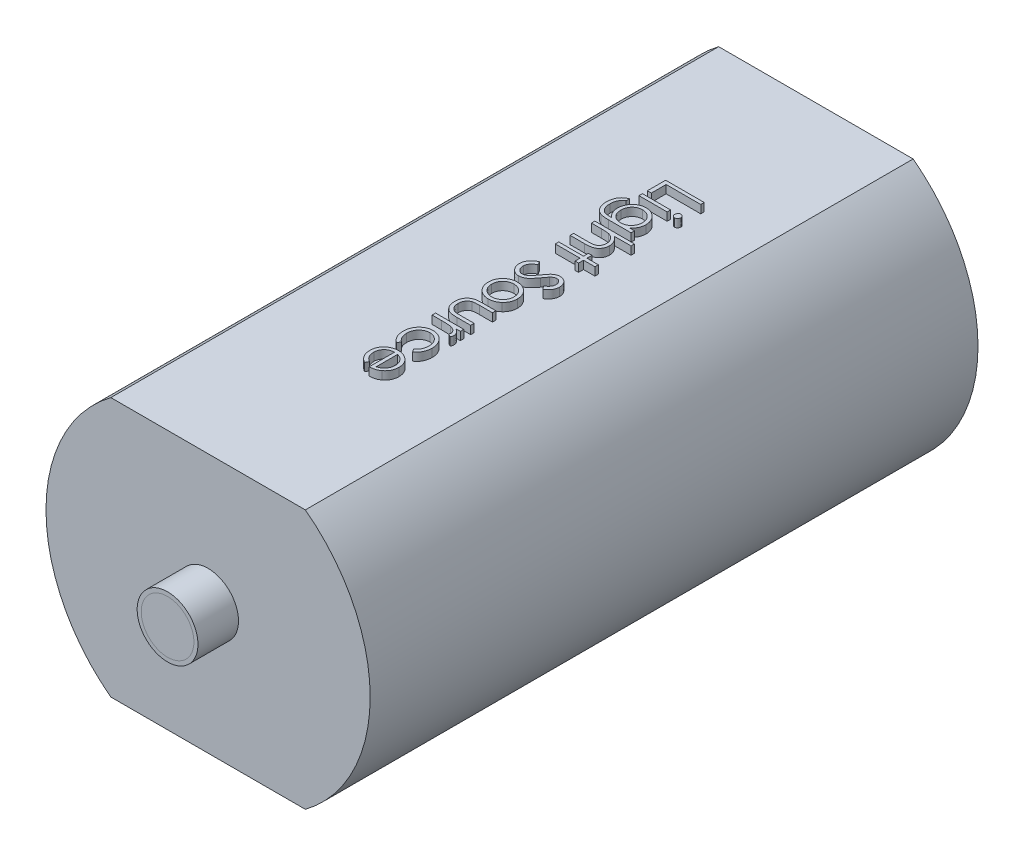
from build123d import *

# Parameters (mm, degrees)
BOSS_EXTRUDE1_DEPTH = 150
BOSS_EXTRUDE2_DEPTH = 2
BOSS_EXTRUDE3_START = -2
BOSS_EXTRUDE3_DEPTH = 2
SKETCH5_R           = 5
CUT_EXTRUDE1_DEPTH  = 5
SKETCH6_W           = 6.960576923
SKETCH6_H           = 0.854807692
BOSS_EXTRUDE4_DEPTH = 2
BOSS_EXTRUDE5_START = 8
SKETCH7_R           = 6.5
SKETCH7_R_2         = 5
BOSS_EXTRUDE5_DEPTH = 8
BOSS_EXTRUDE6_START = 10
SKETCH8_R           = 7.5
SKETCH8_R_2         = 6.5
BOSS_EXTRUDE6_DEPTH = 10
SKETCH9_R           = 6.5
BOSS_EXTRUDE8_DEPTH = 2


with BuildPart() as part:
    # Sketch2 → Boss-Extrude1 (new body)
    with BuildSketch(Plane.XY):
        with BuildLine():
            Line((-24, 32), (24, 32))
            ThreePointArc((24, 32), (40, 0), (24, -32))
            Line((24, -32), (-24, -32))
            ThreePointArc((-24, -32), (-40, 0), (-24, 32))
        make_face()
        with BuildLine():
            Line((-22.803508502, -28.5), (22.803508502, -28.5))
            ThreePointArc((22.803508502, -28.5), (36.5, 0), (22.803508502, 28.5))
            Line((22.803508502, 28.5), (-22.803508502, 28.5))
            ThreePointArc((-22.803508502, 28.5), (-36.5, 0), (-22.803508502, -28.5))
        make_face(mode=Mode.SUBTRACT)
    extrude(amount=BOSS_EXTRUDE1_DEPTH)

    # Sketch3 → Boss-Extrude2 (add)
    with BuildSketch(Plane(origin=(0, 0, 0), x_dir=(-1, 0, 0), z_dir=(0, 0, -1))):
        with BuildLine():
            Line((-24, 32), (24, 32))
            ThreePointArc((24, 32), (40, 0), (24, -32))
            Line((24, -32), (-24, -32))
            ThreePointArc((-24, -32), (-40, 0), (-24, 32))
        make_face()
    extrude(amount=-BOSS_EXTRUDE2_DEPTH)

    # Sketch4 → Boss-Extrude3 (add)
    with BuildSketch(Plane.XY.offset(150).offset(BOSS_EXTRUDE3_START)):
        with BuildLine():
            Line((-24, 32), (24, 32))
            ThreePointArc((24, 32), (40, 0), (24, -32))
            Line((24, -32), (-24, -32))
            ThreePointArc((-24, -32), (-40, 0), (-24, 32))
        make_face()
    extrude(amount=BOSS_EXTRUDE3_DEPTH)

    # Sketch5 → Cut-Extrude1 (cut)
    with BuildSketch(Plane.XY.offset(150)):
        Circle(SKETCH5_R)
    extrude(amount=-CUT_EXTRUDE1_DEPTH, mode=Mode.SUBTRACT)

    # Sketch6 → Boss-Extrude4 (add)
    # profile 1 of 12: a face of its own
    with BuildSketch(Plane(origin=(0, 32, 0), x_dir=(1, 0, 0), z_dir=(0, 1, 0))):
        Polygon((9.525, -37.083173077), (9.525, -37.937980769), (0.976923077, -37.937980769), (0.976923077, -41.601442308), (0, -41.601442308), (0, -37.083173077), align=None)
    # profile 2 of 12: a face of its own
    with BuildSketch(Plane(origin=(0, 32, 0), x_dir=(1, 0, 0), z_dir=(0, 1, 0))):
        with BuildLine():
            add(Edge.make_bspline(
                [(9.891346154, -43.246183894), (9.888874894, -43.299219261), (9.884035694, -43.403072696), (9.842926421, -43.553403032), (9.772180781, -43.690151542), (9.680351215, -43.813254251), (9.567915071, -43.915300738), (9.440162758, -43.9884735), (9.301084477, -44.035186768), (9.204177694, -44.040860982), (9.15483774, -44.04375)],
                knots=[0, 0, 0, 0, 1.054986045, 2.065865298, 3.074122704, 4.105114675, 5.109626121, 6.074217918, 7.019490725, 8, 8, 8, 8], degree=3))
            add(Edge.make_bspline(
                [(9.15483774, -44.04375), (9.106778498, -44.040796353), (9.011771064, -44.034957341), (8.875104224, -43.988508032), (8.749130834, -43.91468727), (8.636914511, -43.813322172), (8.545137995, -43.690133603), (8.474378339, -43.553407777), (8.43327277, -43.403071448), (8.428433059, -43.299218839), (8.425961538, -43.246183894)],
                knots=[0, 0, 0, 0, 0.961106377, 1.899993565, 2.859409042, 3.870007927, 4.90724781, 5.921615355, 6.938620636, 8, 8, 8, 8], degree=3))
            add(Edge.make_bspline(
                [(8.425961538, -43.246183894), (8.428353682, -43.193758068), (8.433009677, -43.091718046), (8.474870132, -42.944151843), (8.544984123, -42.809603665), (8.638184575, -42.688514146), (8.74838467, -42.58513934), (8.87519938, -42.511590956), (9.011746837, -42.465017456), (9.10677036, -42.459195181), (9.15483774, -42.45625)],
                knots=[0, 0, 0, 0, 1.055304112, 2.054011575, 3.063363921, 4.096942562, 5.122536081, 6.088009498, 7.032825006, 8, 8, 8, 8], degree=3))
            add(Edge.make_bspline(
                [(9.15483774, -42.45625), (9.204186142, -42.459130237), (9.301109515, -42.464787205), (9.440065974, -42.511627105), (9.568667601, -42.584518305), (9.679082072, -42.68858094), (9.772334315, -42.809586178), (9.842434763, -42.944156396), (9.884298758, -43.091716837), (9.888954262, -43.193757657), (9.891346154, -43.246183894)],
                knots=[0, 0, 0, 0, 0.986662878, 1.937868148, 2.908513651, 3.927890639, 4.955204348, 5.958438607, 6.951092507, 8, 8, 8, 8], degree=3))
        make_face()
    # profile 3 of 12: a face of its own
    with BuildSketch(Plane(origin=(0, 32, 0), x_dir=(1, 0, 0), z_dir=(0, 1, 0))):
        with Locations((3.480288462, -43.25)):
            Rectangle(SKETCH6_W, SKETCH6_H)
    # profile 4 of 12: a face of its own
    with BuildSketch(Plane(origin=(0, 32, 0), x_dir=(1, 0, 0), z_dir=(0, 1, 0))):
        with BuildLine():
            Line((6.960576923, -51.737019231), (6.960576923, -52.591826923))
            Line((6.960576923, -52.591826923), (1.436763822, -52.591826923))
            add(Edge.make_bspline(
                [(1.436763822, -52.591826923), (1.319095797, -52.591072972), (1.091968164, -52.589617663), (0.763550846, -52.57913752), (0.460203856, -52.557037677), (0.180543709, -52.531976909), (-0.074133319, -52.495926916), (-0.304587169, -52.451904088), (-0.511038992, -52.40227699), (-0.638197309, -52.358679113), (-0.698347356, -52.338055889)],
                knots=[0, 0, 0, 0, 1.307562039, 2.523909702, 3.650326591, 4.686913197, 5.643429486, 6.506965704, 7.293745905, 8, 8, 8, 8], degree=3))
            add(Edge.make_bspline(
                [(-0.698347356, -52.338055889), (-0.776536507, -52.307608124), (-0.930577004, -52.247622962), (-1.148889906, -52.13522473), (-1.354628821, -52.009559353), (-1.545442913, -51.865524337), (-1.72433437, -51.706763564), (-1.88817937, -51.530361741), (-2.039520798, -51.339455439), (-2.175364408, -51.132491085), (-2.29439933, -50.91156535), (-2.399758422, -50.679616526), (-2.490753345, -50.437315148), (-2.559052217, -50.182330588), (-2.618191216, -49.918536009), (-2.6566879, -49.642863926), (-2.682886441, -49.356915362), (-2.685309258, -49.162481926), (-2.686538462, -49.063837139)],
                knots=[0, 0, 0, 0, 0.981884813, 1.934411902, 2.870642727, 3.801527012, 4.729816098, 5.667674509, 6.616731011, 7.579249157, 8.562291171, 9.552107921, 10.560574871, 11.588648803, 12.640348669, 13.724070705, 14.845319185, 16, 16, 16, 16], degree=3))
            add(Edge.make_bspline(
                [(-2.686538462, -49.063837139), (-2.684212763, -48.919913681), (-2.679670049, -48.638792499), (-2.626554881, -48.228951716), (-2.551939987, -47.84021894), (-2.437815674, -47.477513583), (-2.298736214, -47.142237326), (-2.140327407, -46.835894723), (-1.956858752, -46.56352425), (-1.748745355, -46.318217761), (-1.501172588, -46.096863957), (-1.209445115, -45.888596924), (-0.869082516, -45.688134995), (-0.619275499, -45.570654474), (-0.488461538, -45.509134615)],
                knots=[0, 0, 0, 0, 1.157931887, 2.261752077, 3.322178827, 4.340878186, 5.316509817, 6.24181319, 7.112369066, 7.954886437, 8.824930176, 9.778504873, 10.836691706, 12, 12, 12, 12], degree=3))
            Line((-0.488461538, -45.509134615), (-0.488461538, -46.363942308))
            add(Edge.make_bspline(
                [(-0.488461538, -46.363942308), (-0.597606815, -46.432691606), (-0.81097239, -46.567088018), (-1.087233192, -46.818407813), (-1.323326278, -47.093833601), (-1.513583456, -47.402660453), (-1.657029388, -47.746173361), (-1.759287873, -48.124578985), (-1.820509857, -48.540956527), (-1.82788845, -48.830838238), (-1.831730769, -48.981790865)],
                knots=[0, 0, 0, 0, 0.997731894, 1.950442991, 2.880492273, 3.800895997, 4.748200782, 5.754801363, 6.83083817, 8, 8, 8, 8], degree=3))
            add(Edge.make_bspline(
                [(-1.831730769, -48.981790865), (-1.827856415, -49.130838927), (-1.820387048, -49.418188672), (-1.75898545, -49.831942712), (-1.657286173, -50.209870079), (-1.514366806, -50.549132128), (-1.337851416, -50.844603781), (-1.142558315, -51.100204133), (-0.921552992, -51.307380219), (-0.718057281, -51.446763229), (-0.536742051, -51.533397415), (-0.380661615, -51.588567193), (-0.204168968, -51.633399821), (-0.007856768, -51.670900697), (0.208555758, -51.701845815), (0.445563344, -51.721447948), (0.702627371, -51.735615192), (0.880862269, -51.736540396), (0.973106971, -51.737019231)],
                knots=[0, 0, 0, 0, 1.570672572, 3.028099501, 4.397683431, 5.686589315, 6.895122698, 8.017723291, 9.066023084, 10.075791025, 10.603605416, 11.180458235, 11.81795017, 12.521450677, 13.286658401, 14.121327423, 15.027701111, 16, 16, 16, 16], degree=3))
            Line((0.973106971, -51.737019231), (1.333728966, -51.737019231))
            add(Edge.make_bspline(
                [(1.333728966, -51.737019231), (1.230473062, -51.650257047), (1.025777493, -51.4782588), (0.757549039, -51.181222145), (0.526537498, -50.856781825), (0.337075357, -50.505490184), (0.185542337, -50.135952182), (0.079561851, -49.752170255), (0.01109098, -49.357584734), (0.003723213, -49.090198526), (0, -48.955078125)],
                knots=[0, 0, 0, 0, 1.012485704, 2.007162095, 2.997754123, 3.998611389, 4.999708251, 5.992315798, 6.98544096, 8, 8, 8, 8], degree=3))
            add(Edge.make_bspline(
                [(0, -48.955078125), (0.001401608, -48.875513706), (0.004188237, -48.717326432), (0.02856891, -48.482318155), (0.063944058, -48.250777819), (0.115872832, -48.023245426), (0.182525315, -47.799392649), (0.265846586, -47.579589422), (0.360049144, -47.362056017), (0.471009469, -47.150746705), (0.594459553, -46.947765559), (0.72818824, -46.75464548), (0.871491429, -46.572391142), (1.025797613, -46.402762468), (1.190826863, -46.245888966), (1.365029516, -46.100006429), (1.549775924, -45.966433691), (1.745137993, -45.846901887), (1.946352573, -45.737697746), (2.15438347, -45.644199193), (2.367914601, -45.566583371), (2.5842765, -45.498179967), (2.80741461, -45.449741906), (3.034684282, -45.412703335), (3.267472046, -45.391922305), (3.424281329, -45.38866051), (3.503185096, -45.387019231)],
                knots=[0, 0, 0, 0, 1.028796061, 2.045417375, 3.052978994, 4.056772505, 5.061374657, 6.071351207, 7.095367434, 8.125609542, 9.155490328, 10.16637099, 11.162041966, 12.151987513, 13.129482149, 14.104793677, 15.088808581, 16.075021637, 17.065069715, 18.0481558, 19.021557435, 20.00254184, 20.980451754, 21.971763498, 22.979425854, 24, 24, 24, 24], degree=3))
            add(Edge.make_bspline(
                [(3.503185096, -45.387019231), (3.582115328, -45.388431116), (3.739670084, -45.391249418), (3.973379087, -45.415623544), (4.203985134, -45.450316479), (4.428986177, -45.505514043), (4.651630435, -45.571009735), (4.868293123, -45.655954952), (5.081841561, -45.753822676), (5.290403069, -45.865680814), (5.492058859, -45.99089403), (5.68267881, -46.128720032), (5.863848478, -46.276277569), (6.033244189, -46.436536188), (6.192135627, -46.608548575), (6.339128504, -46.792814743), (6.476879752, -46.987285199), (6.602366064, -47.192626019), (6.713352678, -47.40565156), (6.814623934, -47.620954369), (6.894998975, -47.841385226), (6.965818968, -48.062834794), (7.015989038, -48.289202987), (7.054693853, -48.517714252), (7.078274273, -48.7491509), (7.081217729, -48.904144136), (7.082692308, -48.981790865)],
                knots=[0, 0, 0, 0, 1.008914434, 2.013921196, 3.001938835, 3.98818112, 4.973517748, 5.967241793, 6.960633033, 7.975722852, 8.991170928, 9.993245185, 10.981396684, 11.976616977, 12.972235889, 13.973022409, 14.988340224, 16.01763096, 17.047082309, 18.058647952, 19.057085865, 20.044802253, 21.029198803, 22.0185208, 23.007341325, 24, 24, 24, 24], degree=3))
            add(Edge.make_bspline(
                [(7.082692308, -48.981790865), (7.079057748, -49.109846972), (7.071898471, -49.362089154), (7.013979645, -49.734040119), (6.923706773, -50.09334427), (6.79247814, -50.441842207), (6.614889534, -50.781661128), (6.377964948, -51.110755863), (6.086384261, -51.434760282), (5.860533524, -51.633700644), (5.743239183, -51.737019231)],
                knots=[0, 0, 0, 0, 0.967343326, 1.905452219, 2.838102277, 3.762990896, 4.713322225, 5.726933809, 6.819495538, 8, 8, 8, 8], degree=3))
            Line((5.743239183, -51.737019231), (6.960576923, -51.737019231))
        make_face()
        with BuildLine():
            add(Edge.make_bspline(
                [(6.227884615, -49.050480769), (6.223636325, -48.925483586), (6.21522561, -48.678015668), (6.14342095, -48.315281741), (6.0309031, -47.965093733), (5.869942876, -47.634164328), (5.67377244, -47.324133342), (5.435976632, -47.049214849), (5.165183465, -46.808305294), (4.861271923, -46.60704186), (4.534894664, -46.445322634), (4.191315396, -46.327748507), (3.834492943, -46.254283337), (3.591303756, -46.245998797), (3.468840144, -46.241826923)],
                knots=[0, 0, 0, 0, 1.026331696, 2.03191913, 3.02692423, 4.041490544, 5.047661868, 6.033509946, 7.018359977, 8.017132933, 9.01989117, 10.003339456, 10.994534818, 12, 12, 12, 12], degree=3))
            add(Edge.make_bspline(
                [(3.468840144, -46.241826923), (3.376492611, -46.243801117), (3.194872018, -46.24768378), (2.928348957, -46.285044364), (2.674464372, -46.345361457), (2.43337267, -46.431084349), (2.20276399, -46.536604856), (1.98690216, -46.672518961), (1.781826533, -46.828942259), (1.591751715, -47.008368635), (1.418376344, -47.205777586), (1.266831323, -47.419759668), (1.141181567, -47.649142979), (1.034197908, -47.890262268), (0.955495923, -48.148222335), (0.895549708, -48.419155062), (0.861227364, -48.704877759), (0.856975503, -48.899655789), (0.854807692, -48.998963341)],
                knots=[0, 0, 0, 0, 1.039892369, 2.045164194, 3.025377528, 3.974939947, 4.923826224, 5.876304068, 6.842270891, 7.825700405, 8.815919897, 9.798017152, 10.773083594, 11.758208475, 12.764450271, 13.80592145, 14.881349344, 16, 16, 16, 16], degree=3))
            add(Edge.make_bspline(
                [(0.854807692, -48.998963341), (0.856896685, -49.09955757), (0.860981689, -49.296268517), (0.896097642, -49.583572272), (0.952763151, -49.855804258), (1.033216856, -50.112714695), (1.13587375, -50.355274194), (1.265786118, -50.580755772), (1.413732898, -50.794002234), (1.586312168, -50.988174957), (1.776469446, -51.163842177), (1.983529788, -51.316614807), (2.203497171, -51.447822291), (2.439176067, -51.552250178), (2.687452139, -51.638390889), (2.952511814, -51.692697383), (3.230453889, -51.731646122), (3.420991701, -51.735200969), (3.518449519, -51.737019231)],
                knots=[0, 0, 0, 0, 1.121992135, 2.194043731, 3.223932285, 4.220423016, 5.193184374, 6.156086365, 7.118779155, 8.084057622, 9.048292205, 10.002025119, 10.950065319, 11.899697616, 12.87359713, 13.875731462, 14.913461982, 16, 16, 16, 16], degree=3))
            add(Edge.make_bspline(
                [(3.518449519, -51.737019231), (3.645316681, -51.733373692), (3.893170533, -51.726251591), (4.254322496, -51.659040032), (4.59387163, -51.550672206), (4.910743453, -51.398689143), (5.20158266, -51.208238531), (5.460994665, -50.978845435), (5.689343867, -50.714475393), (5.879493437, -50.415851608), (6.033696536, -50.094135124), (6.147859499, -49.757643976), (6.214032895, -49.407327073), (6.223232664, -49.170323757), (6.227884615, -49.050480769)],
                knots=[0, 0, 0, 0, 1.070930318, 2.092221514, 3.091405799, 4.074392322, 5.052047932, 6.019043127, 6.99061078, 7.993717296, 9.000730765, 9.998165278, 10.987753177, 12, 12, 12, 12], degree=3))
        make_face(mode=Mode.SUBTRACT)
    # profile 5 of 12: a face of its own
    with BuildSketch(Plane(origin=(0, 32, 0), x_dir=(1, 0, 0), z_dir=(0, 1, 0))):
        with BuildLine():
            Line((9.769230769, -54.545673077), (9.769230769, -55.400480769))
            Line((9.769230769, -55.400480769), (5.645928486, -55.400480769))
            add(Edge.make_bspline(
                [(5.645928486, -55.400480769), (5.76047368, -55.492377719), (5.983145158, -55.671021875), (6.276608294, -55.969802772), (6.527135899, -56.280343163), (6.729033709, -56.607867075), (6.887190807, -56.947824842), (7.000945042, -57.301986669), (7.069352045, -57.670968677), (7.078214125, -57.922004731), (7.082692308, -58.048858173)],
                knots=[0, 0, 0, 0, 1.125719942, 2.188356526, 3.205611246, 4.180516366, 5.132291467, 6.075069812, 7.02729502, 8, 8, 8, 8], degree=3))
            add(Edge.make_bspline(
                [(7.082692308, -58.048858173), (7.07793518, -58.177660974), (7.068624335, -58.429759123), (6.995208914, -58.796878483), (6.869034563, -59.140018157), (6.6981125, -59.458631141), (6.484084226, -59.744283907), (6.235635383, -59.995031702), (5.949910061, -60.201572759), (5.685134355, -60.341894529), (5.44963969, -60.43327679), (5.247606949, -60.491108681), (5.022486202, -60.540147692), (4.774387578, -60.582873079), (4.502121887, -60.611349068), (4.206916923, -60.634221606), (3.888789774, -60.650486108), (3.668571094, -60.651116401), (3.554702524, -60.651442308)],
                knots=[0, 0, 0, 0, 1.23557613, 2.418320525, 3.575024647, 4.733016537, 5.875704003, 6.989294038, 8.107658508, 9.246262776, 9.854990416, 10.529125826, 11.260725398, 12.065539328, 12.943870397, 13.886749146, 14.907300446, 16, 16, 16, 16], degree=3))
            Line((3.554702524, -60.651442308), (0, -60.651442308))
            Line((0, -60.651442308), (0, -59.796634615))
            Line((0, -59.796634615), (3.27421875, -59.796634615))
            add(Edge.make_bspline(
                [(3.27421875, -59.796634615), (3.368986158, -59.796116719), (3.550260081, -59.795126071), (3.809792133, -59.791851255), (4.045185185, -59.784540912), (4.255684832, -59.772727664), (4.441584538, -59.760303506), (4.602614336, -59.743203907), (4.738995396, -59.723309628), (4.821086278, -59.705433158), (4.857902644, -59.697415865)],
                knots=[0, 0, 0, 0, 1.430932559, 2.737130458, 3.918967929, 4.986496826, 5.920444988, 6.731744033, 7.431208747, 8, 8, 8, 8], degree=3))
            add(Edge.make_bspline(
                [(4.857902644, -59.697415865), (4.965928174, -59.666325749), (5.173606626, -59.606555183), (5.455710805, -59.467629752), (5.696263256, -59.294121134), (5.891901863, -59.08224022), (6.046007113, -58.835380504), (6.151078342, -58.552300309), (6.218061824, -58.236419145), (6.22451281, -58.014247051), (6.227884615, -57.898121995)],
                knots=[0, 0, 0, 0, 1.090097712, 2.095706502, 3.037208793, 3.95517211, 4.879102211, 5.845071496, 6.873660557, 8, 8, 8, 8], degree=3))
            add(Edge.make_bspline(
                [(6.227884615, -57.898121995), (6.226589688, -57.829357555), (6.22402706, -57.693274506), (6.198298951, -57.491484208), (6.156256367, -57.295734399), (6.099366158, -57.104139901), (6.021953662, -56.920761341), (5.932336504, -56.740253543), (5.822640467, -56.567730731), (5.699561771, -56.40012933), (5.563300497, -56.244143757), (5.419481283, -56.099017821), (5.266332988, -55.969645624), (5.106312672, -55.85243753), (4.937225434, -55.751259481), (4.760701825, -55.662940736), (4.5765097, -55.588004305), (4.448670425, -55.550767836), (4.384705529, -55.532136418)],
                knots=[0, 0, 0, 0, 1.024319606, 2.027102035, 3.025350316, 4.005802111, 5.00026367, 5.987881639, 7.005602596, 8.042517216, 9.083927026, 10.089214625, 11.084353441, 12.06828073, 13.041928858, 14.016821737, 15.00770877, 16, 16, 16, 16], degree=3))
            add(Edge.make_bspline(
                [(4.384705529, -55.532136418), (4.338384227, -55.521415548), (4.237444408, -55.498053454), (4.070962855, -55.4727038), (3.877506371, -55.450013082), (3.65736838, -55.430830957), (3.409742214, -55.419065987), (3.136317675, -55.406388917), (2.835382047, -55.401669922), (2.626116416, -55.400889), (2.516721755, -55.400480769)],
                knots=[0, 0, 0, 0, 0.607992626, 1.324890765, 2.152360218, 3.099583803, 4.150613268, 5.323148443, 6.60066238, 8, 8, 8, 8], degree=3))
            Line((2.516721755, -55.400480769), (0, -55.400480769))
            Line((0, -55.400480769), (0, -54.545673077))
            Line((0, -54.545673077), (9.769230769, -54.545673077))
        make_face()
    # profile 6 of 12: a face of its own
    with BuildSketch(Plane(origin=(0, 32, 0), x_dir=(1, 0, 0), z_dir=(0, 1, 0))):
        Polygon((9.769230769, -63.460096154), (9.769230769, -64.314903846), (6.960576923, -64.314903846), (6.960576923, -65.536057692), (6.105769231, -65.536057692), (6.105769231, -64.314903846), (0, -64.314903846), (0, -63.460096154), (6.105769231, -63.460096154), (6.105769231, -62.238942308), (6.960576923, -62.238942308), (6.960576923, -63.460096154), align=None)
    # profile 7 of 12: a face of its own
    with BuildSketch(Plane(origin=(0, 32, 0), x_dir=(1, 0, 0), z_dir=(0, 1, 0))):
        with BuildLine():
            Line((1.837454928, -70.054326923), (2.320192308, -70.85952524))
            add(Edge.make_bspline(
                [(2.320192308, -70.85952524), (2.194831374, -70.934414157), (1.954644664, -71.077898433), (1.630092425, -71.317251774), (1.354242556, -71.565263483), (1.128699788, -71.823770169), (0.951129604, -72.091193928), (0.82539353, -72.369280531), (0.746972911, -72.657092859), (0.737447676, -72.852964473), (0.732692308, -72.950751202)],
                knots=[0, 0, 0, 0, 1.272034388, 2.437168799, 3.508375237, 4.49857839, 5.41946034, 6.295179144, 7.148887113, 8, 8, 8, 8], degree=3))
            add(Edge.make_bspline(
                [(0.732692308, -72.950751202), (0.735018235, -73.034263309), (0.739629391, -73.199826259), (0.783936474, -73.44356338), (0.852005035, -73.680278618), (0.949489744, -73.905090341), (1.06743016, -74.114906992), (1.209894196, -74.298871143), (1.369359642, -74.458008409), (1.54739263, -74.587825301), (1.738199915, -74.688602996), (1.935806546, -74.761528524), (2.139343317, -74.807941237), (2.277335103, -74.813848644), (2.346905048, -74.816826923)],
                knots=[0, 0, 0, 0, 1.095270387, 2.171376115, 3.241375676, 4.322296363, 5.380636668, 6.392615365, 7.366724986, 8.328592944, 9.273498763, 10.190095884, 11.087518669, 12, 12, 12, 12], degree=3))
            add(Edge.make_bspline(
                [(2.346905048, -74.816826923), (2.426209789, -74.812814692), (2.587424739, -74.804658412), (2.825276652, -74.735720598), (3.060660003, -74.627273719), (3.206259876, -74.52722681), (3.281850962, -74.475285457)],
                knots=[0, 0, 0, 0, 0.938893495, 1.908633276, 2.914225137, 4, 4, 4, 4], degree=3))
            add(Edge.make_bspline(
                [(3.281850962, -74.475285457), (3.336518486, -74.432759731), (3.451623, -74.343220226), (3.620094315, -74.187155311), (3.798118858, -74.008788198), (3.984973711, -73.807227179), (4.17724644, -73.578465642), (4.378944988, -73.327200926), (4.589463177, -73.052132338), (4.728676799, -72.858276427), (4.800661058, -72.758037861)],
                knots=[0, 0, 0, 0, 0.72226686, 1.520759855, 2.393439377, 3.351307446, 4.386958158, 5.510256019, 6.712608938, 8, 8, 8, 8], degree=3))
            add(Edge.make_bspline(
                [(4.800661058, -72.758037861), (4.872056623, -72.657837353), (5.008559508, -72.466261612), (5.210888665, -72.198140798), (5.397053846, -71.958703226), (5.564461836, -71.746728842), (5.720414125, -71.567701694), (5.856552542, -71.415077048), (5.980146722, -71.294485805), (6.060260055, -71.227379623), (6.096228966, -71.197250601)],
                knots=[0, 0, 0, 0, 1.452255772, 2.776602448, 3.96446981, 5.032613149, 5.964194703, 6.766668629, 7.446264616, 8, 8, 8, 8], degree=3))
            add(Edge.make_bspline(
                [(6.096228966, -71.197250601), (6.152293217, -71.155143174), (6.262551089, -71.072333269), (6.434885166, -70.963024354), (6.611297053, -70.870117061), (6.792260799, -70.797285285), (6.975235855, -70.735954576), (7.162609602, -70.69470335), (7.353541271, -70.668873191), (7.482029441, -70.666227999), (7.546349159, -70.664903846)],
                knots=[0, 0, 0, 0, 1.068054152, 2.10047183, 3.106115577, 4.101338837, 5.06977816, 6.043150881, 7.020423561, 8, 8, 8, 8], degree=3))
            add(Edge.make_bspline(
                [(7.546349159, -70.664903846), (7.647131483, -70.668440385), (7.84654198, -70.675437871), (8.137696321, -70.73510008), (8.416519271, -70.828169183), (8.676869209, -70.962774355), (8.918137305, -71.129196189), (9.136637375, -71.325880654), (9.321887548, -71.559400163), (9.481867178, -71.817044837), (9.608177785, -72.097236855), (9.703965527, -72.390318337), (9.757516741, -72.697574457), (9.765287727, -72.906034896), (9.769230769, -73.011808894)],
                knots=[0, 0, 0, 0, 1.005541892, 1.989591032, 2.955705311, 3.932863626, 4.905387107, 5.876519979, 6.856563935, 7.871847665, 8.897921447, 9.918317993, 10.943742853, 12, 12, 12, 12], degree=3))
            add(Edge.make_bspline(
                [(9.769230769, -73.011808894), (9.765431918, -73.124068498), (9.75789834, -73.346692717), (9.690050361, -73.674777388), (9.580454393, -73.99126258), (9.45422642, -74.246017652), (9.328719872, -74.445055117), (9.214357771, -74.596833994), (9.082710789, -74.750642981), (8.933414555, -74.907718314), (8.76510325, -75.065399748), (8.578928385, -75.226027837), (8.376028061, -75.389978318), (8.231181382, -75.495449622), (8.156926082, -75.549519231)],
                knots=[0, 0, 0, 0, 1.286821612, 2.551921131, 3.825787379, 5.12137259, 5.803616487, 6.523126609, 7.299589446, 8.125436757, 9.008162487, 9.944516264, 10.946261234, 12, 12, 12, 12], degree=3))
            Line((8.156926082, -75.549519231), (7.571153846, -74.776757812))
            add(Edge.make_bspline(
                [(7.571153846, -74.776757812), (7.631266641, -74.730096383), (7.747029829, -74.640237378), (7.909148887, -74.503813553), (8.057239525, -74.375229757), (8.185867946, -74.24854609), (8.302079565, -74.13045368), (8.401571659, -74.015834307), (8.485333921, -73.906342157), (8.574679105, -73.768308175), (8.663807537, -73.594448181), (8.737621096, -73.376418883), (8.783575179, -73.149192973), (8.789364857, -72.994854799), (8.792307692, -72.91640625)],
                knots=[0, 0, 0, 0, 1.181667846, 2.275615987, 3.290305621, 4.226321945, 5.078535498, 5.862783384, 6.581873284, 7.217493746, 8.414623899, 9.604724551, 10.782505457, 12, 12, 12, 12], degree=3))
            add(Edge.make_bspline(
                [(8.792307692, -72.91640625), (8.789010137, -72.818008857), (8.782651114, -72.628258754), (8.713200296, -72.358863897), (8.603848234, -72.116401144), (8.450591043, -71.908068806), (8.269014628, -71.734613175), (8.060066458, -71.609140463), (7.829337205, -71.533620372), (7.668387412, -71.524404854), (7.586418269, -71.519711538)],
                knots=[0, 0, 0, 0, 1.14458467, 2.207223713, 3.21896685, 4.227309161, 5.202851033, 6.127160689, 7.046193047, 8, 8, 8, 8], degree=3))
            add(Edge.make_bspline(
                [(7.586418269, -71.519711538), (7.53540047, -71.520831211), (7.433281448, -71.523072386), (7.282011827, -71.552221263), (7.132084974, -71.593553494), (6.982834225, -71.654045761), (6.830748343, -71.735526127), (6.676237941, -71.84631493), (6.515402003, -71.984916284), (6.410898736, -72.091295772), (6.355724159, -72.147460937)],
                knots=[0, 0, 0, 0, 0.858526328, 1.718456515, 2.587092892, 3.476767204, 4.426280253, 5.487868114, 6.673670035, 8, 8, 8, 8], degree=3))
            add(Edge.make_bspline(
                [(6.355724159, -72.147460937), (6.337117681, -72.168310815), (6.29291295, -72.217845352), (6.220543958, -72.308403407), (6.131273556, -72.427990594), (6.020818073, -72.573484156), (5.892689237, -72.747566762), (5.748525335, -72.950257554), (5.583646336, -73.179297154), (5.468373315, -73.341826082), (5.407421875, -73.427764423)],
                knots=[0, 0, 0, 0, 0.420754252, 0.999615792, 1.744751191, 2.668019286, 3.750313428, 4.999500688, 6.413464383, 8, 8, 8, 8], degree=3))
            add(Edge.make_bspline(
                [(5.407421875, -73.427764423), (5.332197889, -73.531140373), (5.186537067, -73.731313572), (4.967691538, -74.0161317), (4.753657253, -74.274378421), (4.545801051, -74.506960425), (4.345699598, -74.71617544), (4.150945514, -74.89970238), (3.962934063, -75.059411267), (3.721890125, -75.231348997), (3.425850174, -75.407038492), (3.063142968, -75.557918594), (2.699025838, -75.65305524), (2.454296376, -75.665496292), (2.333548678, -75.671634615)],
                knots=[0, 0, 0, 0, 1.163667725, 2.253281268, 3.268753668, 4.215851969, 5.092017293, 5.902905408, 6.650798638, 7.335211899, 8.59617414, 9.77448103, 10.901945474, 12, 12, 12, 12], degree=3))
            add(Edge.make_bspline(
                [(2.333548678, -75.671634615), (2.248155372, -75.669845267), (2.07902704, -75.666301319), (1.830673077, -75.625600708), (1.589506904, -75.565894176), (1.358291026, -75.47618692), (1.133931584, -75.365838521), (0.918495244, -75.22954241), (0.714943584, -75.065237536), (0.519040714, -74.882619322), (0.342084101, -74.67966979), (0.18381623, -74.465678931), (0.051347016, -74.239257492), (-0.055291043, -74.00150138), (-0.140015533, -73.753725811), (-0.200913726, -73.49567003), (-0.238375181, -73.226615429), (-0.242257116, -73.043732507), (-0.244230769, -72.950751202)],
                knots=[0, 0, 0, 0, 0.983610584, 1.948120116, 2.894308362, 3.843560551, 4.801159957, 5.773581695, 6.77566113, 7.813174769, 8.857584665, 9.875476876, 10.877851407, 11.875574773, 12.875048225, 13.892438445, 14.928473903, 16, 16, 16, 16], degree=3))
            add(Edge.make_bspline(
                [(-0.244230769, -72.950751202), (-0.242823685, -72.878812479), (-0.240027237, -72.735841028), (-0.215890529, -72.52493658), (-0.180493753, -72.317904978), (-0.126526491, -72.117345752), (-0.059507723, -71.920761577), (0.022547063, -71.729904742), (0.120229114, -71.544311554), (0.233700223, -71.363765288), (0.364471679, -71.186564682), (0.515597147, -71.013618191), (0.686032773, -70.842947292), (0.877526416, -70.677680646), (1.088032159, -70.514771957), (1.319313837, -70.357250807), (1.57017085, -70.2019096), (1.746696134, -70.104439994), (1.837454928, -70.054326923)],
                knots=[0, 0, 0, 0, 0.915384692, 1.819241058, 2.699029451, 3.586605375, 4.459625921, 5.340865773, 6.228072412, 7.126546901, 8.052715223, 9.028303326, 10.047266019, 11.120332924, 12.245748783, 13.433636234, 14.680528497, 16, 16, 16, 16], degree=3))
        make_face()
    # profile 8 of 12: a face of its own
    with BuildSketch(Plane(origin=(0, 32, 0), x_dir=(1, 0, 0), z_dir=(0, 1, 0))):
        with BuildLine():
            add(Edge.make_bspline(
                [(7.082692308, -80.743239183), (7.079919465, -80.873847246), (7.074482599, -81.129937739), (7.016087731, -81.504926147), (6.927535643, -81.86250479), (6.802887059, -82.204207575), (6.639343249, -82.527207929), (6.441570115, -82.834389713), (6.208229615, -83.125137477), (6.027625667, -83.299364311), (5.935952524, -83.387800481)],
                knots=[0, 0, 0, 0, 1.054042676, 2.066720093, 3.05716247, 4.025731183, 4.997454851, 5.974904663, 6.97207755, 8, 8, 8, 8], degree=3))
            add(Edge.make_bspline(
                [(5.935952524, -83.387800481), (5.848284463, -83.46395137), (5.674644959, -83.614779419), (5.393097898, -83.808179697), (5.101523767, -83.9747898), (4.796050685, -84.108311144), (4.47934533, -84.213589672), (4.150319142, -84.288335603), (3.809698755, -84.332795404), (3.578366881, -84.338790621), (3.461207933, -84.341826923)],
                knots=[0, 0, 0, 0, 1.025258237, 2.030674902, 3.01204498, 3.988269485, 4.97094183, 5.956517959, 6.965070386, 8, 8, 8, 8], degree=3))
            add(Edge.make_bspline(
                [(3.461207933, -84.341826923), (3.343369918, -84.339156284), (3.110516507, -84.333878976), (2.767563807, -84.283958133), (2.435019315, -84.206312825), (2.114275335, -84.095191877), (1.804351218, -83.952703085), (1.506601468, -83.778828906), (1.220435433, -83.572350631), (0.948295382, -83.338293361), (0.697442488, -83.079629657), (0.47894031, -82.798958667), (0.2909535, -82.501592579), (0.141639703, -82.183472052), (0.021282384, -81.84912543), (-0.061711734, -81.496426062), (-0.112340398, -81.125688582), (-0.118811222, -80.872515562), (-0.122115385, -80.743239183)],
                knots=[0, 0, 0, 0, 0.998669827, 1.973418153, 2.932281609, 3.89081133, 4.846438734, 5.82045571, 6.809776312, 7.834649874, 8.860672198, 9.859676908, 10.845817165, 11.837296335, 12.833502054, 13.853824644, 14.904110009, 16, 16, 16, 16], degree=3))
            add(Edge.make_bspline(
                [(-0.122115385, -80.743239183), (-0.118783884, -80.613335643), (-0.112258971, -80.358912999), (-0.062088339, -79.986779537), (0.022169141, -79.632595193), (0.140149706, -79.296667036), (0.292179917, -78.978547798), (0.478208871, -78.680083681), (0.697553133, -78.399280303), (0.948265402, -78.140535504), (1.220443157, -77.906499977), (1.506599463, -77.700016092), (1.80435174, -77.52614337), (2.114275196, -77.383654196), (2.435019352, -77.27253335), (2.767563797, -77.194888015), (3.110516509, -77.144967179), (3.343369919, -77.139689871), (3.461207933, -77.137019231)],
                knots=[0, 0, 0, 0, 1.099861214, 2.154133753, 3.1731438, 4.178222029, 5.163564916, 6.153006591, 7.15072618, 8.175428628, 9.198983792, 10.187031731, 11.15979573, 12.114193814, 13.071490482, 14.029120454, 15.002614863, 16, 16, 16, 16], degree=3))
            add(Edge.make_bspline(
                [(3.461207933, -77.137019231), (3.577730104, -77.14007624), (3.808423978, -77.146128592), (4.14840405, -77.190543692), (4.476873373, -77.264998049), (4.792356276, -77.370402778), (5.096490712, -77.505154833), (5.388785288, -77.669423767), (5.669059231, -77.864796845), (5.84247432, -78.015025013), (5.930228365, -78.091045673)],
                knots=[0, 0, 0, 0, 1.031353054, 2.041901799, 3.029428768, 4.008703097, 4.981709435, 5.96992636, 6.972712378, 8, 8, 8, 8], degree=3))
            add(Edge.make_bspline(
                [(5.930228365, -78.091045673), (6.022681078, -78.179355834), (6.204505605, -78.353033304), (6.437385713, -78.645123201), (6.637825304, -78.950983595), (6.801286809, -79.276067412), (6.927309478, -79.618720326), (7.016501031, -79.978956566), (7.074224303, -80.355309856), (7.079841509, -80.61264072), (7.082692308, -80.743239183)],
                knots=[0, 0, 0, 0, 1.027951202, 2.021646915, 2.998468564, 3.9668038, 4.943370589, 5.93035926, 6.949632805, 8, 8, 8, 8], degree=3))
        make_face()
        with BuildLine():
            add(Edge.make_bspline(
                [(6.227884615, -80.739423077), (6.225259406, -80.647064396), (6.220076757, -80.464731257), (6.180661893, -80.196343605), (6.118204326, -79.937976292), (6.029502637, -79.689106163), (5.91482809, -79.450695764), (5.774773178, -79.222482775), (5.608591955, -79.005080322), (5.41958743, -78.800158525), (5.21429537, -78.609883319), (4.993543688, -78.445470562), (4.76366532, -78.305409208), (4.523467025, -78.188852134), (4.270674013, -78.102011095), (4.008106952, -78.038949515), (3.7352423, -77.999569209), (3.549746886, -77.994435644), (3.455483774, -77.991826923)],
                knots=[0, 0, 0, 0, 1.021589593, 2.016807015, 2.994807536, 3.958602519, 4.934347097, 5.916793557, 6.916107818, 7.957073844, 8.998039869, 10.008589932, 10.997041759, 11.972786337, 12.956492182, 13.948170289, 14.957322718, 16, 16, 16, 16], degree=3))
            add(Edge.make_bspline(
                [(3.455483774, -77.991826923), (3.333688947, -77.99618824), (3.09194899, -78.004844638), (2.736035004, -78.075595211), (2.393705219, -78.19311521), (2.069081375, -78.355167417), (1.768206957, -78.554739585), (1.497659262, -78.788098305), (1.267871693, -79.058469842), (1.074616478, -79.356647527), (0.922428178, -79.678405803), (0.81328893, -80.018350255), (0.743296999, -80.373385587), (0.736258142, -80.616342744), (0.732692308, -80.739423077)],
                knots=[0, 0, 0, 0, 1.016977094, 2.018509362, 3.018404954, 4.033172147, 5.041280572, 6.028085189, 7.007940189, 7.995502847, 8.989109012, 9.972200833, 10.97273166, 12, 12, 12, 12], degree=3))
            add(Edge.make_bspline(
                [(0.732692308, -80.739423077), (0.736237486, -80.862510489), (0.74323557, -81.105481622), (0.813643533, -81.461010939), (0.921953602, -81.80188707), (1.074788366, -82.123979892), (1.267141239, -82.422293368), (1.49896834, -82.690734267), (1.767495737, -82.926102641), (2.068682436, -83.125872422), (2.394209887, -83.285313519), (2.735971927, -83.403386181), (3.091965054, -83.473967074), (3.333694329, -83.482646375), (3.455483774, -83.487019231)],
                knots=[0, 0, 0, 0, 1.027082318, 2.027431966, 3.015401697, 4.008827937, 4.996211763, 5.971861488, 6.96198607, 7.969911943, 8.982141629, 9.981856156, 10.983207064, 12, 12, 12, 12], degree=3))
            add(Edge.make_bspline(
                [(3.455483774, -83.487019231), (3.549754413, -83.48442992), (3.735264638, -83.479334552), (4.00802156, -83.439676423), (4.271193335, -83.377594444), (4.522448285, -83.286950612), (4.764838462, -83.174393845), (4.992853401, -83.030925336), (5.214435704, -82.867278381), (5.419463694, -82.676654025), (5.609282535, -82.471755298), (5.774167817, -82.252719598), (5.91490807, -82.02440062), (6.02951676, -81.785914877), (6.117862911, -81.53760793), (6.180933967, -81.280025033), (6.219933047, -81.012825929), (6.22521714, -80.831140241), (6.227884615, -80.739423077)],
                knots=[0, 0, 0, 0, 1.043020522, 2.052505155, 3.044509714, 4.030878336, 5.003918577, 5.996372628, 7.007255355, 8.048564058, 9.08987276, 10.095126797, 11.077896669, 12.053962454, 13.01807471, 13.98956039, 14.985105429, 16, 16, 16, 16], degree=3))
        make_face(mode=Mode.SUBTRACT)
    # profile 9 of 12: a face of its own
    with BuildSketch(Plane(origin=(0, 32, 0), x_dir=(1, 0, 0), z_dir=(0, 1, 0))):
        with BuildLine():
            Line((6.960576923, -85.929326923), (6.960576923, -86.784134615))
            Line((6.960576923, -86.784134615), (3.732151442, -86.784134615))
            add(Edge.make_bspline(
                [(3.732151442, -86.784134615), (3.637383818, -86.784520799), (3.456097791, -86.785259551), (3.195234747, -86.790269541), (2.957336408, -86.802053581), (2.742265345, -86.816786918), (2.550057944, -86.835733874), (2.381385551, -86.858276448), (2.234335379, -86.883472581), (2.145770961, -86.90813611), (2.104582332, -86.91960637)],
                knots=[0, 0, 0, 0, 1.388932606, 2.656963016, 3.823490214, 4.879454478, 5.816252168, 6.653371382, 7.373723809, 8, 8, 8, 8], degree=3))
            add(Edge.make_bspline(
                [(2.104582332, -86.91960637), (2.052813091, -86.938007308), (1.95035088, -86.974426632), (1.802332992, -87.040483429), (1.665248056, -87.12220993), (1.533763028, -87.211611373), (1.411947019, -87.314843488), (1.299004406, -87.43039684), (1.193617677, -87.556220379), (1.066512853, -87.740526951), (0.932000699, -87.992476322), (0.814319386, -88.322522081), (0.745022571, -88.681036325), (0.73687836, -88.929115233), (0.732692308, -89.056625601)],
                knots=[0, 0, 0, 0, 0.725930277, 1.436768641, 2.137297926, 2.832005607, 3.535753883, 4.242956221, 4.964984144, 5.701683124, 7.198126434, 8.723945959, 10.316137162, 12, 12, 12, 12], degree=3))
            add(Edge.make_bspline(
                [(0.732692308, -89.056625601), (0.736862725, -89.184152126), (0.744911265, -89.430267141), (0.813273136, -89.785035436), (0.924799893, -90.109933508), (1.082661848, -90.401167879), (1.275116075, -90.656910297), (1.501035242, -90.870004805), (1.753169672, -91.04583021), (1.941287029, -91.122599949), (2.035892428, -91.161207933)],
                knots=[0, 0, 0, 0, 1.157091467, 2.233085092, 3.266839029, 4.264239195, 5.228693433, 6.160074799, 7.074690074, 8, 8, 8, 8], degree=3))
            add(Edge.make_bspline(
                [(2.035892428, -91.161207933), (2.073899905, -91.172630674), (2.157925153, -91.197883564), (2.300489512, -91.224821672), (2.470337328, -91.250092346), (2.669252306, -91.266940052), (2.895480339, -91.286168464), (3.150191345, -91.292808083), (3.431883967, -91.302289805), (3.629104721, -91.302364709), (3.732151442, -91.302403846)],
                knots=[0, 0, 0, 0, 0.557560243, 1.232629526, 2.036798082, 2.970922211, 4.03790722, 5.227863888, 6.551574656, 8, 8, 8, 8], degree=3))
            Line((3.732151442, -91.302403846), (6.960576923, -91.302403846))
            Line((6.960576923, -91.302403846), (6.960576923, -92.157211538))
            Line((6.960576923, -92.157211538), (3.571875, -92.157211538))
            add(Edge.make_bspline(
                [(3.571875, -92.157211538), (3.456739053, -92.1560095), (3.233359565, -92.153677382), (2.908736406, -92.138689501), (2.606216194, -92.112973191), (2.325639373, -92.073940142), (2.067218223, -92.028042946), (1.830627972, -91.968829725), (1.61657616, -91.898148744), (1.421378626, -91.81833894), (1.244210349, -91.724315606), (1.077056506, -91.623570276), (0.920195365, -91.510504377), (0.772855916, -91.386119279), (0.635572581, -91.25097364), (0.508943843, -91.104164559), (0.390728761, -90.948636786), (0.283240303, -90.781678956), (0.187424857, -90.603120563), (0.10388622, -90.413859992), (0.034874451, -90.212516652), (-0.021555278, -90.001346018), (-0.068281494, -89.778580957), (-0.099602499, -89.545181995), (-0.119540172, -89.300571352), (-0.121242566, -89.134260858), (-0.122115385, -89.048993389)],
                knots=[0, 0, 0, 0, 1.492959813, 2.896546261, 4.212934643, 5.4282803, 6.568701279, 7.614836728, 8.587629399, 9.489753423, 10.345563548, 11.185732697, 12.018869657, 12.849922188, 13.68387515, 14.5140269, 15.361852057, 16.215154979, 17.085973896, 17.987004002, 18.894652782, 19.842944701, 20.819888734, 21.843945232, 22.894589698, 24, 24, 24, 24], degree=3))
            add(Edge.make_bspline(
                [(-0.122115385, -89.048993389), (-0.121190896, -88.964366447), (-0.119374189, -88.798066628), (-0.09993827, -88.554032742), (-0.067803177, -88.320129749), (-0.021932907, -88.097189236), (0.035323419, -87.884987484), (0.103368755, -87.682664945), (0.187952066, -87.492590677), (0.28314099, -87.312481081), (0.390815061, -87.14374601), (0.508838083, -86.985607665), (0.637033869, -86.838278088), (0.774867034, -86.701724781), (0.924047411, -86.577864467), (1.083374971, -86.465153667), (1.251271027, -86.361857205), (1.431057205, -86.26836854), (1.628556746, -86.188054406), (1.84707956, -86.117146915), (2.089021409, -86.059151535), (2.354175443, -86.011955246), (2.641272663, -85.973987397), (2.951973851, -85.947627253), (3.285522184, -85.932888456), (3.515890814, -85.930539696), (3.634840745, -85.929326923)],
                knots=[0, 0, 0, 0, 1.083640291, 2.129454052, 3.13281866, 4.105697902, 5.042300162, 5.946461698, 6.836384745, 7.703652036, 8.553297018, 9.397182691, 10.228592656, 11.052265423, 11.879314572, 12.708807002, 13.549817954, 14.402308542, 15.300838682, 16.27712199, 17.341985831, 18.484375296, 19.725102775, 21.0496083, 22.476576903, 24, 24, 24, 24], degree=3))
            Line((3.634840745, -85.929326923), (6.960576923, -85.929326923))
        make_face()
    # profile 10 of 12: a face of its own
    with BuildSketch(Plane(origin=(0, 32, 0), x_dir=(1, 0, 0), z_dir=(0, 1, 0))):
        with BuildLine():
            Line((6.960576923, -93.866826923), (6.960576923, -94.721634615))
            Line((6.960576923, -94.721634615), (5.935952524, -94.721634615))
            add(Edge.make_bspline(
                [(5.935952524, -94.721634615), (6.031364438, -94.784733584), (6.213838983, -94.905409872), (6.455016645, -95.106112715), (6.655595729, -95.311631033), (6.813617657, -95.524520708), (6.932931397, -95.743002063), (7.021059128, -95.96344208), (7.072285584, -96.190407247), (7.079218753, -96.343234441), (7.082692308, -96.419801683)],
                knots=[0, 0, 0, 0, 1.280622107, 2.44917983, 3.507334186, 4.490567186, 5.408878616, 6.288712897, 7.142636019, 8, 8, 8, 8], degree=3))
            add(Edge.make_bspline(
                [(7.082692308, -96.419801683), (7.079524856, -96.479219717), (7.073040609, -96.600857326), (7.025202251, -96.78555011), (6.951723756, -96.976624912), (6.880935274, -97.099929296), (6.844185697, -97.163942308)],
                knots=[0, 0, 0, 0, 0.90119973, 1.844890732, 2.881183062, 4, 4, 4, 4], degree=3))
            Line((6.844185697, -97.163942308), (6.103861178, -96.694561298))
            add(Edge.make_bspline(
                [(6.103861178, -96.694561298), (6.122204331, -96.653443176), (6.157023146, -96.57539311), (6.198231045, -96.461216754), (6.222495073, -96.355948259), (6.226170954, -96.288882575), (6.227884615, -96.257617187)],
                knots=[0, 0, 0, 0, 1.180555205, 2.24091978, 3.179933427, 4, 4, 4, 4], degree=3))
            add(Edge.make_bspline(
                [(6.227884615, -96.257617187), (6.223480624, -96.188332283), (6.214577993, -96.048273431), (6.139601897, -95.842940967), (6.023559245, -95.64279114), (5.89028311, -95.48586007), (5.764226913, -95.363419783), (5.653546276, -95.275996899), (5.529524052, -95.195749061), (5.394183388, -95.119089501), (5.245241446, -95.04923944), (5.084178146, -94.98404883), (4.910809306, -94.925105693), (4.790025431, -94.891495398), (4.728155048, -94.874278846)],
                knots=[0, 0, 0, 0, 1.135927944, 2.296268816, 3.551388088, 4.924624343, 5.663947748, 6.437790805, 7.238014523, 8.089896346, 8.992356783, 9.939655789, 10.944608424, 12, 12, 12, 12], degree=3))
            add(Edge.make_bspline(
                [(4.728155048, -94.874278846), (4.672972169, -94.861399976), (4.550746284, -94.832874256), (4.345690656, -94.805138714), (4.103419127, -94.77773524), (3.823257328, -94.7584223), (3.505904891, -94.740520628), (3.150878354, -94.730423904), (2.757813305, -94.721978929), (2.483018815, -94.721752868), (2.339272837, -94.721634615)],
                knots=[0, 0, 0, 0, 0.566838948, 1.255505196, 2.06880316, 3.007127437, 4.065329342, 5.249902469, 6.561414163, 8, 8, 8, 8], degree=3))
            Line((2.339272837, -94.721634615), (0, -94.721634615))
            Line((0, -94.721634615), (0, -93.866826923))
            Line((0, -93.866826923), (6.960576923, -93.866826923))
        make_face()
    # profile 11 of 12: a face of its own
    with BuildSketch(Plane(origin=(0, 32, 0), x_dir=(1, 0, 0), z_dir=(0, 1, 0))):
        with BuildLine():
            Line((5.451307091, -104.979326923), (5.006730769, -104.263807091))
            add(Edge.make_bspline(
                [(5.006730769, -104.263807091), (5.104243444, -104.185353051), (5.29618059, -104.030929592), (5.54373969, -103.762699585), (5.757230567, -103.476702206), (5.928886334, -103.167545003), (6.064390884, -102.837936681), (6.158564764, -102.487198188), (6.217758301, -102.115437745), (6.224453871, -101.860526753), (6.227884615, -101.729912861)],
                knots=[0, 0, 0, 0, 1.026629843, 2.020746545, 2.988156479, 3.951609825, 4.916760838, 5.907688704, 6.927920211, 8, 8, 8, 8], degree=3))
            add(Edge.make_bspline(
                [(6.227884615, -101.729912861), (6.225008321, -101.625521822), (6.219343536, -101.419926511), (6.183938891, -101.11810158), (6.119589867, -100.830609821), (6.034847211, -100.555611789), (5.921107685, -100.295199777), (5.783530289, -100.048644231), (5.621528813, -99.815120485), (5.436270337, -99.598338275), (5.232789548, -99.400773923), (5.017905152, -99.226044755), (4.790112629, -99.08021002), (4.553735374, -98.958645118), (4.304706888, -98.867181901), (4.046052508, -98.799922101), (3.776070227, -98.758924541), (3.592368884, -98.753957103), (3.49936899, -98.751442308)],
                knots=[0, 0, 0, 0, 1.11253269, 2.191102883, 3.232049486, 4.248096668, 5.252846381, 6.25411548, 7.252444123, 8.276484619, 9.287796331, 10.271127345, 11.222403915, 12.165070373, 13.097940083, 14.043161362, 15.009338842, 16, 16, 16, 16], degree=3))
            add(Edge.make_bspline(
                [(3.49936899, -98.751442308), (3.377527446, -98.756273478), (3.135486067, -98.765870722), (2.778301044, -98.841420161), (2.43230759, -98.964294248), (2.102130122, -99.135767106), (1.795996368, -99.349103723), (1.519190916, -99.598040776), (1.283238672, -99.88810106), (1.085764893, -100.210771074), (0.92637748, -100.560224694), (0.813907537, -100.933691735), (0.745641668, -101.327991829), (0.737065135, -101.597980658), (0.732692308, -101.735637019)],
                knots=[0, 0, 0, 0, 0.966447457, 1.919872872, 2.884287729, 3.873230387, 4.863319139, 5.838939256, 6.818209587, 7.819967013, 8.834377336, 9.85802846, 10.90789553, 12, 12, 12, 12], degree=3))
            add(Edge.make_bspline(
                [(0.732692308, -101.735637019), (0.736228796, -101.861789342), (0.743178935, -102.109712134), (0.801768471, -102.472117388), (0.897681503, -102.81713986), (1.031433322, -103.144767286), (1.204318919, -103.454400995), (1.417567805, -103.744040393), (1.665045267, -104.019448796), (1.856410603, -104.181365568), (1.953846154, -104.263807091)],
                knots=[0, 0, 0, 0, 1.039848629, 2.043578496, 3.018386758, 3.987534228, 4.954977003, 5.934852016, 6.948509513, 8, 8, 8, 8], degree=3))
            Line((1.953846154, -104.263807091), (1.484465144, -104.979326923))
            add(Edge.make_bspline(
                [(1.484465144, -104.979326923), (1.422170175, -104.936905742), (1.297787, -104.852204181), (1.122399355, -104.710620126), (0.958266807, -104.557873607), (0.80543836, -104.394682487), (0.661233244, -104.223117826), (0.529738169, -104.038713862), (0.4076257, -103.844609897), (0.296964509, -103.639915381), (0.197710862, -103.42664624), (0.111816164, -103.204795966), (0.039192394, -102.975366725), (-0.019572003, -102.738874064), (-0.066061621, -102.494944786), (-0.096981065, -102.243764644), (-0.120040188, -101.985380642), (-0.121417656, -101.810740966), (-0.122115385, -101.722280649)],
                knots=[0, 0, 0, 0, 0.954067324, 1.904967979, 2.850944488, 3.791040077, 4.734579251, 5.686741025, 6.656553487, 7.63677735, 8.631289747, 9.633371755, 10.647134148, 11.676547777, 12.717490898, 13.789379914, 14.88025357, 16, 16, 16, 16], degree=3))
            add(Edge.make_bspline(
                [(-0.122115385, -101.722280649), (-0.11968983, -101.587268173), (-0.114935725, -101.322642741), (-0.062661235, -100.935322195), (0.016144862, -100.565170743), (0.129257547, -100.21231468), (0.274867148, -99.876699683), (0.452730664, -99.558636442), (0.664329086, -99.259186539), (0.905881226, -98.981279394), (1.167827855, -98.726133323), (1.450324283, -98.506724485), (1.743946157, -98.317435923), (2.052113037, -98.16133237), (2.375990851, -98.043410211), (2.713044254, -97.959485317), (3.063265364, -97.906052977), (3.302009966, -97.89980312), (3.423046875, -97.896634615)],
                knots=[0, 0, 0, 0, 1.112900083, 2.181292239, 3.217426397, 4.231060065, 5.231907716, 6.230057215, 7.231385915, 8.250448267, 9.26326716, 10.242335464, 11.195469137, 12.140906363, 13.085222324, 14.031808558, 15.002181388, 16, 16, 16, 16], degree=3))
            add(Edge.make_bspline(
                [(3.423046875, -97.896634615), (3.50516219, -97.897907825), (3.668503106, -97.90044045), (3.911265259, -97.926757131), (4.149727737, -97.966173381), (4.383548301, -98.022131533), (4.613434248, -98.092349879), (4.838157861, -98.180600851), (5.059026696, -98.283879566), (5.27332123, -98.404036768), (5.479743784, -98.536578051), (5.677119082, -98.680605643), (5.860392037, -98.838596023), (6.034149479, -99.007206857), (6.193203686, -99.188992624), (6.344426368, -99.380566721), (6.479982822, -99.586656624), (6.60656524, -99.802009849), (6.719076123, -100.02690463), (6.816061782, -100.259758107), (6.898932975, -100.499227566), (6.964544577, -100.745679793), (7.019564605, -100.997483364), (7.054175382, -101.25662138), (7.078630864, -101.522102799), (7.081327237, -101.701869545), (7.082692308, -101.792878606)],
                knots=[0, 0, 0, 0, 0.991083503, 1.971428668, 2.944771278, 3.907728914, 4.872032831, 5.84458753, 6.820199395, 7.813689706, 8.808455339, 9.780676499, 10.761021664, 11.727616056, 12.70141294, 13.675300653, 14.672050164, 15.67696011, 16.690052069, 17.705469636, 18.720567748, 19.746988726, 20.783187267, 21.830086354, 22.901455311, 24, 24, 24, 24], degree=3))
            add(Edge.make_bspline(
                [(7.082692308, -101.792878606), (7.080184114, -101.906852649), (7.075180263, -102.134231039), (7.033046313, -102.471522061), (6.969575169, -102.803867732), (6.875349438, -103.125330224), (6.762118116, -103.431857098), (6.632510267, -103.718231817), (6.485654797, -103.979964201), (6.322403115, -104.21948569), (6.139193309, -104.43774723), (5.932860865, -104.637088225), (5.704653986, -104.821691548), (5.536453008, -104.926348147), (5.451307091, -104.979326923)],
                knots=[0, 0, 0, 0, 1.095247575, 2.185020588, 3.262981163, 4.344680461, 5.40090428, 6.402280576, 7.363136638, 8.282296962, 9.184898179, 10.097200524, 11.036773704, 12, 12, 12, 12], degree=3))
        make_face()
    # profile 12 of 12: a face of its own
    with BuildSketch(Plane(origin=(0, 32, 0), x_dir=(1, 0, 0), z_dir=(0, 1, 0))):
        with BuildLine():
            Line((2.198076923, -112.401652644), (1.79929387, -113.161057692))
            add(Edge.make_bspline(
                [(1.79929387, -113.161057692), (1.691960442, -113.100533681), (1.483132095, -112.982777923), (1.196085887, -112.780421504), (0.93874458, -112.568038614), (0.715091956, -112.338304267), (0.521182616, -112.094047972), (0.352645245, -111.834910924), (0.207442627, -111.561759045), (0.085758751, -111.273629447), (-0.007913769, -110.968032785), (-0.074047647, -110.644119004), (-0.114934734, -110.301298044), (-0.119683683, -110.066312877), (-0.122115385, -109.945988582)],
                knots=[0, 0, 0, 0, 1.120373846, 2.179803828, 3.190307243, 4.151866639, 5.090753574, 6.023181945, 6.960194942, 7.901556876, 8.864247182, 9.862852693, 10.905672442, 12, 12, 12, 12], degree=3))
            add(Edge.make_bspline(
                [(-0.122115385, -109.945988582), (-0.118993429, -109.812252201), (-0.112903397, -109.551371265), (-0.060400336, -109.171623802), (0.025249452, -108.814084128), (0.14489849, -108.478772173), (0.301183005, -108.166509711), (0.491572165, -107.876673821), (0.715091398, -107.607748922), (0.973663626, -107.368176887), (1.25041437, -107.152596149), (1.53865528, -106.962023943), (1.838532942, -106.803812626), (2.145383693, -106.670764332), (2.46203145, -106.569958439), (2.786740762, -106.496168344), (3.121120598, -106.454443152), (3.347251631, -106.447972403), (3.461207933, -106.444711538)],
                knots=[0, 0, 0, 0, 1.145226127, 2.234004399, 3.276654467, 4.290038057, 5.276870678, 6.260645262, 7.254731018, 8.264593254, 9.273837991, 10.257612574, 11.220387342, 12.174754112, 13.118989047, 14.062768009, 15.023752772, 16, 16, 16, 16], degree=3))
            add(Edge.make_bspline(
                [(3.461207933, -106.444711538), (3.568146007, -106.447593916), (3.780083148, -106.453306407), (4.093770094, -106.48931305), (4.398647526, -106.553125905), (4.694968773, -106.640691472), (4.982237695, -106.753770221), (5.260629125, -106.892106475), (5.529846827, -107.055915731), (5.699672498, -107.182387793), (5.785216346, -107.24609375)],
                knots=[0, 0, 0, 0, 1.024358464, 2.0301432, 3.019427413, 4.004406732, 4.986367066, 5.972626655, 6.978780325, 8, 8, 8, 8], degree=3))
            add(Edge.make_bspline(
                [(5.785216346, -107.24609375), (5.888273771, -107.332383944), (6.091124023, -107.502230877), (6.357656181, -107.789494958), (6.580932455, -108.100554779), (6.766009019, -108.431512132), (6.906635158, -108.786213537), (7.011430793, -109.159890965), (7.070153808, -109.55679931), (7.07844827, -109.828139947), (7.082692308, -109.966977163)],
                knots=[0, 0, 0, 0, 1.030682036, 2.02871468, 2.997146059, 3.962720338, 4.930598197, 5.918074684, 6.934738563, 8, 8, 8, 8], degree=3))
            add(Edge.make_bspline(
                [(7.082692308, -109.966977163), (7.07900736, -110.109709575), (7.071778334, -110.38971803), (7.004759526, -110.798019731), (6.898480789, -111.184355681), (6.748383687, -111.548571282), (6.55472805, -111.89070346), (6.314856324, -112.208528352), (6.036132815, -112.507481397), (5.821784367, -112.681404029), (5.712710337, -112.769906851)],
                knots=[0, 0, 0, 0, 1.056321875, 2.072262726, 3.055038591, 4.01806755, 4.982017516, 5.957941055, 6.960871419, 8, 8, 8, 8], degree=3))
            add(Edge.make_bspline(
                [(5.712710337, -112.769906851), (5.630513447, -112.830123733), (5.466666796, -112.950156676), (5.199501004, -113.100507712), (4.919981458, -113.231020337), (4.623589864, -113.335340753), (4.313838006, -113.419812538), (3.988511509, -113.480927166), (3.647707251, -113.516767342), (3.415497125, -113.523812297), (3.297115385, -113.527403846)],
                knots=[0, 0, 0, 0, 0.94817472, 1.890038105, 2.849395472, 3.817997239, 4.812318967, 5.836947057, 6.897266129, 8, 8, 8, 8], degree=3))
            Line((3.297115385, -113.527403846), (3.297115385, -107.299519231))
            add(Edge.make_bspline(
                [(3.297115385, -107.299519231), (3.205403833, -107.303713139), (3.025056766, -107.311960289), (2.761131341, -107.350317089), (2.50983943, -107.411070472), (2.272251728, -107.495519439), (2.047588153, -107.60140973), (1.834300351, -107.727045551), (1.635627503, -107.877848372), (1.448995059, -108.045773016), (1.28285336, -108.232780071), (1.134033558, -108.429448478), (1.009991828, -108.638359553), (0.907790986, -108.85740729), (0.82913037, -109.087727685), (0.774961997, -109.328996848), (0.738774798, -109.580464235), (0.734744247, -109.751873683), (0.732692308, -109.83913762)],
                knots=[0, 0, 0, 0, 1.094405546, 2.152104367, 3.174987145, 4.173015398, 5.153654967, 6.133208507, 7.119289451, 8.123438607, 9.122504012, 10.097966803, 11.060604936, 12.014205423, 12.976096155, 13.956823727, 14.959826266, 16, 16, 16, 16], degree=3))
            add(Edge.make_bspline(
                [(0.732692308, -109.83913762), (0.734335582, -109.924459702), (0.737596154, -110.09375508), (0.769772043, -110.346457478), (0.82094742, -110.595207282), (0.891285763, -110.838217854), (0.977933956, -111.070205517), (1.081797288, -111.285664316), (1.19537617, -111.485320107), (1.327322007, -111.670847409), (1.487153111, -111.850801848), (1.688892897, -112.027068382), (1.925039204, -112.21862288), (2.103496354, -112.338250931), (2.198076923, -112.401652644)],
                knots=[0, 0, 0, 0, 0.990963276, 1.966261236, 2.95471375, 3.93937425, 4.902926125, 5.828461241, 6.715766441, 7.568835615, 8.469155523, 9.505141836, 10.677749234, 12, 12, 12, 12], degree=3))
        make_face()
        with BuildLine():
            add(Edge.make_bspline(
                [(4.151923077, -112.672596154), (4.265333013, -112.641362268), (4.483610633, -112.581247091), (4.78515925, -112.454826511), (5.054711365, -112.315687914), (5.287816288, -112.147746025), (5.493402862, -111.95582114), (5.674880883, -111.736478194), (5.836455149, -111.49023346), (5.972977456, -111.218783035), (6.089144943, -110.931276247), (6.167048804, -110.630272129), (6.220414075, -110.323137003), (6.225383793, -110.115398791), (6.227884615, -110.01086238)],
                knots=[0, 0, 0, 0, 1.154756201, 2.222533969, 3.206705588, 4.129403772, 5.035894089, 5.963342549, 6.920206228, 7.923656548, 8.944970878, 9.96070521, 10.973801891, 12, 12, 12, 12], degree=3))
            add(Edge.make_bspline(
                [(6.227884615, -110.01086238), (6.226212969, -109.925549484), (6.222908476, -109.756903826), (6.19179485, -109.508400363), (6.139695602, -109.269317285), (6.070312944, -109.038338182), (5.9747177, -108.819483496), (5.864901648, -108.607057872), (5.729981898, -108.406308466), (5.627236921, -108.280732961), (5.575330529, -108.217292668)],
                knots=[0, 0, 0, 0, 1.048700258, 2.073059931, 3.073189922, 4.055269162, 5.032885305, 6.005420607, 6.992345662, 8, 8, 8, 8], degree=3))
            add(Edge.make_bspline(
                [(5.575330529, -108.217292668), (5.534252427, -108.171863094), (5.45112036, -108.079924707), (5.307893734, -107.957078002), (5.153448411, -107.839456573), (4.981875608, -107.732412846), (4.795129059, -107.634230272), (4.594783924, -107.542354905), (4.379319905, -107.459660455), (4.229172052, -107.413134613), (4.151923077, -107.389197716)],
                knots=[0, 0, 0, 0, 0.879870761, 1.780643979, 2.707998968, 3.669668524, 4.684282772, 5.740141944, 6.837334558, 8, 8, 8, 8], degree=3))
            Line((4.151923077, -107.389197716), (4.151923077, -112.672596154))
        make_face(mode=Mode.SUBTRACT)
    extrude(amount=BOSS_EXTRUDE4_DEPTH)

    # Sketch7 → Boss-Extrude5 (add)
    with BuildSketch(Plane.XY.offset(150).offset(BOSS_EXTRUDE5_START)):
        Circle(SKETCH7_R)
        Circle(SKETCH7_R_2, mode=Mode.SUBTRACT)
    extrude(amount=-BOSS_EXTRUDE5_DEPTH)

    # Sketch8 → Boss-Extrude6 (add)
    with BuildSketch(Plane.XY.offset(150).offset(BOSS_EXTRUDE6_START)):
        Circle(SKETCH8_R)
        Circle(SKETCH8_R_2, mode=Mode.SUBTRACT)
    extrude(amount=-BOSS_EXTRUDE6_DEPTH)


with BuildPart() as body_2:
    # Sketch9 → Boss-Extrude8 (new body)
    with BuildSketch(Plane.XY.offset(160)):
        Circle(SKETCH9_R)
    extrude(amount=-BOSS_EXTRUDE8_DEPTH)


solid = Compound([part.part, body_2.part])
